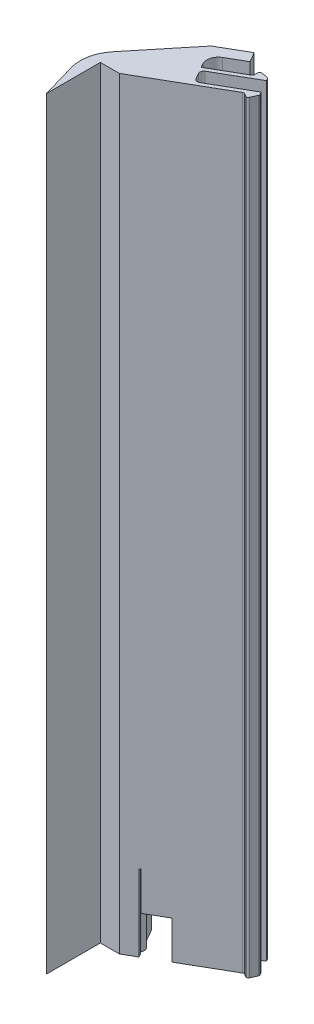
from build123d import *

# Parameters (mm, degrees)
BOSS_EXTRUDE1_DEPTH   = 200
BOSS_EXTRUDE1_2_DEPTH = 200
FILLET1_R             = 0.5
FILLET2_R             = 0.5
BOSS_EXTRUDE3_DEPTH   = 200
FILLET3_R             = 10
FILLET4_R             = 1
FILLET5_R             = 3
CUT_EXTRUDE2_DEPTH    = 20
CUT_EXTRUDE4_DEPTH    = 10


with BuildPart() as part:
    # Sketch1 → Boss-Extrude1 (new body)
    with BuildSketch(Plane(origin=(0, 0, 0), x_dir=(1, 0, 0), z_dir=(0, 1, 0))):
        Polygon((13.927082127, 14.175350351), (16.351953258, 13.843299543), (16.851953258, 12.977274139), (3.059579159, 5.014243241), (2.594699496, 5.900545381), (13.927082127, 12.443299543), align=None)
    extrude(amount=BOSS_EXTRUDE1_DEPTH)

    # Fillet2
    fillet2_edges = [part.edges().sort_by_distance(p)[0] for p in [
        (13.927082127, 100, -14.175350351),
        (16.351953258, 100, -13.843299543),
        (13.927082127, 100, -12.443299543),
    ]]
    fillet(fillet2_edges, radius=FILLET2_R)



with BuildPart() as body_2:
    # Sketch1 → Boss-Extrude1 2 (new body)
    with BuildSketch(Plane(origin=(0, 0, 0), x_dir=(1, 0, 0), z_dir=(0, 1, 0))):
        Polygon((18.751953258, 9.686377605), (19.251953258, 8.820352201), (18.153877046, 6.454326797), (16.653877046, 7.320352201), (5.114206816, 0.657920487), (4.719127398, 1.584521817), align=None)
    extrude(amount=BOSS_EXTRUDE1_2_DEPTH)

    # Fillet1
    fillet1_edges = [body_2.edges().sort_by_distance(p)[0] for p in [
        (19.251953258, 100, -8.820352201),
        (18.153877046, 100, -6.454326797),
        (16.653877046, 100, -7.320352201),
    ]]
    fillet(fillet1_edges, radius=FILLET1_R)


with BuildPart() as part_1:
    add(part.part)

    add(body_2.part)  # Boss-Extrude3 merges body 2
    # Sketch2 → Boss-Extrude3 (add)
    with BuildSketch(Plane(origin=(0, 0, 0), x_dir=(1, 0, 0), z_dir=(0, 1, 0))):
        Polygon((8.182648293, 2.429486), (3.232648293, 11.003137498), (10.393111947, 15.137233116), (8.893111947, 17.735309327), (1.732648293, 13.601213709), (-13.163737181, -4.647533202), (-9.075108531, -18.787281313), (-9.075108531, -4.647533202), (-4.075108531, -4.647533202), align=None)
    extrude(amount=BOSS_EXTRUDE3_DEPTH)

    # Fillet3
    fillet3_edges = [part_1.edges().sort_by_distance(p)[0] for p in [
        (-13.163737181, 100, 4.647533202),
    ]]
    fillet(fillet3_edges, radius=FILLET3_R)

    # Fillet4
    fillet4_edges = [part_1.edges().sort_by_distance(p)[0] for p in [
        (5.782648293, 100, -6.586407938),
        (7.682648293, 100, -3.295511404),
    ]]
    fillet(fillet4_edges, radius=FILLET4_R)

    # Fillet5
    fillet5_edges = [part_1.edges().sort_by_distance(p)[0] for p in [
        (3.232648293, 100, -11.003137498),
    ]]
    fillet(fillet5_edges, radius=FILLET5_R)

    # Sketch3 → Cut-Extrude2 (cut)
    with BuildSketch(Plane(origin=(0, 0, 0), x_dir=(1, 0, 0), z_dir=(0, 1, 0))):
        with BuildLine():
            Line((-6.589903921, 8.016296992), (-2.313602471, 0.609525612))
            ThreePointArc((-2.313602471, 0.609525612), (-4.361026605, -1.438580666), (-1.563602471, -0.689512493))
            Line((-1.563602471, -0.689512493), (0.970355299, -5.078456095))
            Line((0.970355299, -5.078456095), (0.623945137, -5.278456095))
            Line((0.623945137, -5.278456095), (-1.448316815, -1.689193106))
            ThreePointArc((-1.448316815, -1.689193106), (-4.707436766, -1.638580666), (-3.12170845, 1.209206225))
            Line((-3.12170845, 1.209206225), (-6.936314083, 7.816296992))
            Line((-6.936314083, 7.816296992), (-6.589903921, 8.016296992))
        make_face()
    extrude(amount=CUT_EXTRUDE2_DEPTH, mode=Mode.SUBTRACT)

    # Sketch4 → Cut-Extrude4 (cut)
    with BuildSketch(Plane(origin=(0, 0, 0), x_dir=(1, 0, 0), z_dir=(0, 1, 0))):
        with BuildLine():
            Line((-2.313602471, 0.609525612), (-5.030743669, 5.315752219))
            Line((-5.030743669, 5.315752219), (-2.055391297, 8.960693639))
            Line((-2.055391297, 8.960693639), (4.693297418, 0.414908333))
            Line((4.693297418, 0.414908333), (-0.477605745, -2.570514))
            Line((-0.477605745, -2.570514), (-1.563602471, -0.689512493))
            ThreePointArc((-1.563602471, -0.689512493), (-1.76444841, 0.060554453), (-2.313602471, 0.609525612))
        make_face()
    extrude(amount=CUT_EXTRUDE4_DEPTH, mode=Mode.SUBTRACT)


solid = part_1.part
